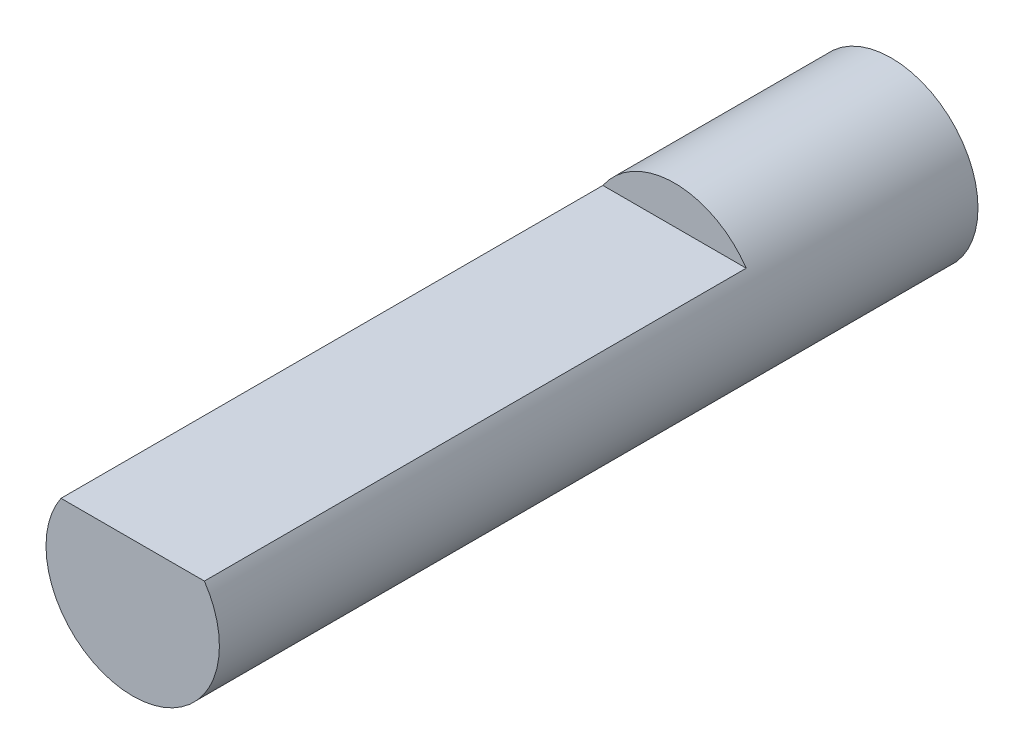
from build123d import *

# Parameters (mm, degrees)
SKETCH1_R           = 1.6
BOSS_EXTRUDE1_DEPTH = 14
CUT_EXTRUDE1_DEPTH  = 10


with BuildPart() as part:
    # Sketch1 → Boss-Extrude1 (new body)
    with BuildSketch(Plane.XY):
        Circle(SKETCH1_R)
    extrude(amount=BOSS_EXTRUDE1_DEPTH)

    # Sketch3 → Cut-Extrude1 (cut)
    with BuildSketch(Plane.XY.offset(14)):
        Polygon((-19.015262047, 0.9), (-1.322875656, 0.9), (1.322875656, 0.9), (19.015262047, 0.9), (19.015262047, 36.284772782), (-19.015262047, 36.284772782), align=None)
    extrude(amount=-CUT_EXTRUDE1_DEPTH, mode=Mode.SUBTRACT)


solid = part.part
